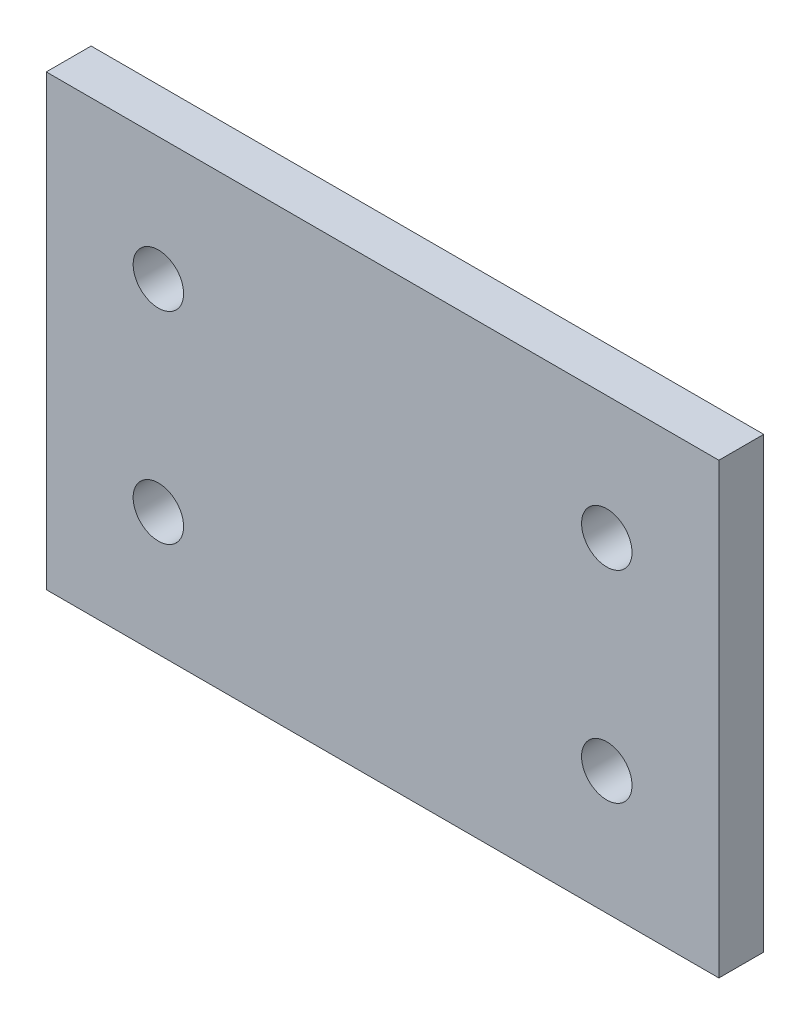
from build123d import *

# Parameters (mm, degrees)
SKETCH_1_W          = 60
SKETCH_1_H          = 40
EXTRUDE_1_DEPTH     = 4
SKETCH_2_R          = 2.25
CUT_EXTRUDE_1_DEPTH = 73.221880341


with BuildPart() as part:
    # 草图1 → 凸台-拉伸1 (new body)
    with BuildSketch(Plane.XY):
        with Locations((30, 20)):
            Rectangle(SKETCH_1_W, SKETCH_1_H)
    extrude(amount=EXTRUDE_1_DEPTH)

    # 草图2 → 切除-拉伸1 (cut, through all)
    with BuildSketch(Plane.XY.offset(4)):
        with Locations((10, 11)):
            Circle(SKETCH_2_R)
        with Locations(Location((50, 11, 0), (0, 0, 180))):
            Circle(SKETCH_2_R)
        with Locations((50, 29)):
            Circle(SKETCH_2_R)
        with Locations(Location((10, 29, 0), (0, 0, 180))):
            Circle(SKETCH_2_R)
    extrude(amount=-CUT_EXTRUDE_1_DEPTH, mode=Mode.SUBTRACT)


solid = part.part
